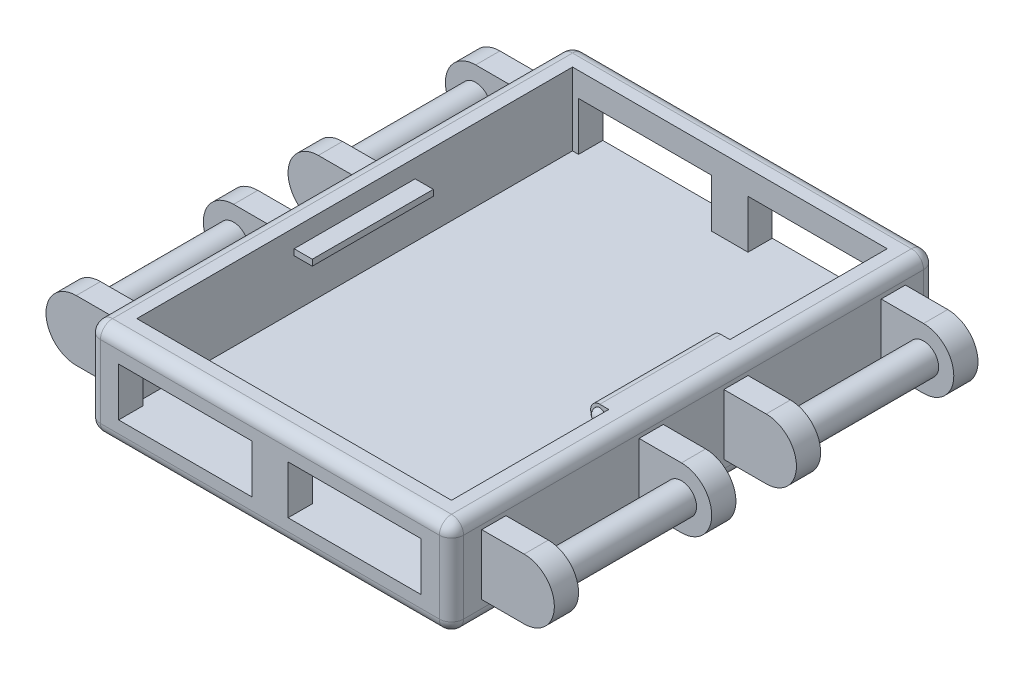
from build123d import *

# Parameters (mm, degrees)
SKETCH2_W                   = 60
SKETCH2_H                   = 80
BOSS_EXTRUDE2_DEPTH         = 16
SKETCH6_W                   = 52
SKETCH6_H                   = 72
CUT_EXTRUDE1_DEPTH          = 12
CUT_EXTRUDE2_DEPTH          = 16
CUT_EXTRUDE2_DEPTH_BACK     = 106
SKETCH7_W                   = 22
SKETCH7_H                   = 8
SKETCH8_W                   = 4
SKETCH8_H                   = 10
BOSS_EXTRUDE3_DEPTH         = 12
FILLET1_RADIUS              = 5
FILLET1_LENGTH              = 4
FILLET2_RADIUS              = 5
FILLET2_LENGTH              = 4
FILLET3_RADIUS              = 5
FILLET3_LENGTH              = 4
FILLET4_RADIUS              = 5
FILLET4_LENGTH              = 4
BOSS_EXTRUDE4_START         = -2
SKETCH9_R                   = 2.5
BOSS_EXTRUDE4_DEPTH         = 26
MIRROR2_START               = -2
MIRROR2_COPY_1_SKETCH_R     = 2.5
MIRROR2_COPY_1_DEPTH        = 26
FILLET1_OF_MIRROR2_2_RADIUS = 5
FILLET1_OF_MIRROR2_2_LENGTH = 4
FILLET2_OF_MIRROR2_2_RADIUS = 5
FILLET2_OF_MIRROR2_2_LENGTH = 4
FILLET3_OF_MIRROR2_2_RADIUS = 5
FILLET3_OF_MIRROR2_2_LENGTH = 4
FILLET4_OF_MIRROR2_2_RADIUS = 5
FILLET4_OF_MIRROR2_2_LENGTH = 4
SKETCH10_W                  = 20
SKETCH10_H                  = 1
BOSS_EXTRUDE5_DEPTH         = 2.999340988
SKETCH12_W                  = 20
SKETCH12_H                  = 3
BOSS_EXTRUDE6_DEPTH         = 3
FILLET6_RADIUS              = 1.5
FILLET6_LENGTH              = 20
FILLET7_R                   = 2
FILLET8_R                   = 2
FILLET9_R                   = 2
FILLET10_R                  = 2
FILLET11_R                  = 2


with BuildPart() as part:
    # Sketch2 → Boss-Extrude2 (new body)
    with BuildSketch(Plane(origin=(0, 0, 0), x_dir=(1, 0, 0), z_dir=(0, 1, 0))):
        Rectangle(SKETCH2_W, SKETCH2_H)
    extrude(amount=BOSS_EXTRUDE2_DEPTH)

    # Sketch6 → Cut-Extrude1 (cut)
    with BuildSketch(Plane(origin=(0, 16, 0), x_dir=(1, 0, 0), z_dir=(0, 1, 0))):
        Rectangle(SKETCH6_W, SKETCH6_H)
    extrude(amount=-CUT_EXTRUDE1_DEPTH, mode=Mode.SUBTRACT)

    # Sketch7 → Cut-Extrude2 (cut, two sides: drawn at the far end of the back side and taken through both)
    with BuildSketch(Plane(origin=(0, 0, -40), x_dir=(-1, 0, 0), z_dir=(0, 0, -1)).offset(-CUT_EXTRUDE2_DEPTH_BACK)):
        with Locations((-14, 8)):
            Rectangle(SKETCH7_W, SKETCH7_H)
        with Locations((14, 8)):
            Rectangle(SKETCH7_W, SKETCH7_H)
    extrude(amount=CUT_EXTRUDE2_DEPTH + CUT_EXTRUDE2_DEPTH_BACK, mode=Mode.SUBTRACT)

    # Sketch8 → Boss-Extrude3 (add)
    with BuildSketch(Plane(origin=(30, 0, 0), x_dir=(0, 0, -1), z_dir=(1, 0, 0))):
        with Locations((-33, 8.303078398)):
            Rectangle(SKETCH8_W, SKETCH8_H)
        with Locations((-7, 8.355173675)):
            Rectangle(SKETCH8_W, SKETCH8_H)
        with Locations((7, 8.355173675)):
            Rectangle(SKETCH8_W, SKETCH8_H)
        with Locations((33, 8.303078398)):
            Rectangle(SKETCH8_W, SKETCH8_H)
    boss_extrude3 = extrude(amount=BOSS_EXTRUDE3_DEPTH)

    # Fillet1: full round fillet: the end face becomes a half cylinder, R = half its width
    fillet1_face = Plane((42, 8.303078398, 33), x_dir=(0, 0, 1), z_dir=(1, 0, 0))  # on the end face: x along it, z out of the body
    fillet1_slab = fillet1_face.offset(-FILLET1_RADIUS / 2) * Box(FILLET1_LENGTH, 2 * FILLET1_RADIUS, FILLET1_RADIUS, mode=Mode.PRIVATE)  # the body's end, R deep
    fillet1_round = Plane((37, 8.303078398, 33), x_dir=(1, 0, 0), z_dir=(0, 0, 1)) * Cylinder(FILLET1_RADIUS, FILLET1_LENGTH, mode=Mode.PRIVATE)  # its axis R under the face
    add(fillet1_slab - fillet1_round, mode=Mode.SUBTRACT)

    # Fillet2: full round fillet: the end face becomes a half cylinder, R = half its width
    fillet2_face = Plane((42, 8.355173675, 7), x_dir=(0, 0, 1), z_dir=(1, 0, 0))  # on the end face: x along it, z out of the body
    fillet2_slab = fillet2_face.offset(-FILLET2_RADIUS / 2) * Box(FILLET2_LENGTH, 2 * FILLET2_RADIUS, FILLET2_RADIUS, mode=Mode.PRIVATE)  # the body's end, R deep
    fillet2_round = Plane((37, 8.355173675, 7), x_dir=(1, 0, 0), z_dir=(0, 0, 1)) * Cylinder(FILLET2_RADIUS, FILLET2_LENGTH, mode=Mode.PRIVATE)  # its axis R under the face
    add(fillet2_slab - fillet2_round, mode=Mode.SUBTRACT)

    # Fillet3: full round fillet: the end face becomes a half cylinder, R = half its width
    fillet3_face = Plane((42, 8.355173675, -7), x_dir=(0, 0, -1), z_dir=(1, 0, 0))  # on the end face: x along it, z out of the body
    fillet3_slab = fillet3_face.offset(-FILLET3_RADIUS / 2) * Box(FILLET3_LENGTH, 2 * FILLET3_RADIUS, FILLET3_RADIUS, mode=Mode.PRIVATE)  # the body's end, R deep
    fillet3_round = Plane((37, 8.355173675, -7), x_dir=(1, 0, 0), z_dir=(0, 0, -1)) * Cylinder(FILLET3_RADIUS, FILLET3_LENGTH, mode=Mode.PRIVATE)  # its axis R under the face
    add(fillet3_slab - fillet3_round, mode=Mode.SUBTRACT)

    # Fillet4: full round fillet: the end face becomes a half cylinder, R = half its width
    fillet4_face = Plane((42, 8.303078398, -33), x_dir=(0, 0, -1), z_dir=(1, 0, 0))  # on the end face: x along it, z out of the body
    fillet4_slab = fillet4_face.offset(-FILLET4_RADIUS / 2) * Box(FILLET4_LENGTH, 2 * FILLET4_RADIUS, FILLET4_RADIUS, mode=Mode.PRIVATE)  # the body's end, R deep
    fillet4_round = Plane((37, 8.303078398, -33), x_dir=(1, 0, 0), z_dir=(0, 0, -1)) * Cylinder(FILLET4_RADIUS, FILLET4_LENGTH, mode=Mode.PRIVATE)  # its axis R under the face
    add(fillet4_slab - fillet4_round, mode=Mode.SUBTRACT)

    # Sketch9 → Boss-Extrude4 (add)
    with BuildSketch(Plane(origin=(0, 0, 31), x_dir=(-1, 0, 0), z_dir=(0, 0, -1)).offset(BOSS_EXTRUDE4_START)):
        with Locations(Location((-37, 8.303078398, 0), (0, 0, 180))):
            Circle(SKETCH9_R)
    boss_extrude4 = extrude(amount=BOSS_EXTRUDE4_DEPTH)

    # Mirror1: Boss-Extrude4 across plane
    add(boss_extrude4.mirror(Plane(origin=(0, 0, 0), x_dir=(1, 0, 0), z_dir=(0, 0, -1))))

    # Mirror2: Boss-Extrude3, Boss-Extrude4 across plane
    add(boss_extrude3.mirror(Plane(origin=(0, 0, 0), x_dir=(0, 0, 1), z_dir=(1, 0, 0))))
    add(boss_extrude4.mirror(Plane(origin=(0, 0, 0), x_dir=(0, 0, 1), z_dir=(1, 0, 0))))

    # Mirror2 copy 1 sketch → Mirror2 copy 1 (add)
    with BuildSketch(Plane.XY.offset(-31).offset(MIRROR2_START)):
        with Locations(Location((-37, 8.303078398, 0), (0, 0, 180))):
            Circle(MIRROR2_COPY_1_SKETCH_R)
    extrude(amount=MIRROR2_COPY_1_DEPTH)

    # Fillet1 of Mirror2 2: full round fillet: the end face becomes a half cylinder, R = half its width
    fillet1_of_mirror2_2_face = Plane((-42, 8.303078398, 33), x_dir=(0, 0, 1), z_dir=(-1, 0, 0))  # on the end face: x along it, z out of the body
    fillet1_of_mirror2_2_slab = fillet1_of_mirror2_2_face.offset(-FILLET1_OF_MIRROR2_2_RADIUS / 2) * Box(FILLET1_OF_MIRROR2_2_LENGTH, 2 * FILLET1_OF_MIRROR2_2_RADIUS, FILLET1_OF_MIRROR2_2_RADIUS, mode=Mode.PRIVATE)  # the body's end, R deep
    fillet1_of_mirror2_2_round = Plane((-37, 8.303078398, 33), x_dir=(-1, 0, 0), z_dir=(0, 0, 1)) * Cylinder(FILLET1_OF_MIRROR2_2_RADIUS, FILLET1_OF_MIRROR2_2_LENGTH, mode=Mode.PRIVATE)  # its axis R under the face
    add(fillet1_of_mirror2_2_slab - fillet1_of_mirror2_2_round, mode=Mode.SUBTRACT)

    # Fillet2 of Mirror2 2: full round fillet: the end face becomes a half cylinder, R = half its width
    fillet2_of_mirror2_2_face = Plane((-42, 8.355173675, 7), x_dir=(0, 0, 1), z_dir=(-1, 0, 0))  # on the end face: x along it, z out of the body
    fillet2_of_mirror2_2_slab = fillet2_of_mirror2_2_face.offset(-FILLET2_OF_MIRROR2_2_RADIUS / 2) * Box(FILLET2_OF_MIRROR2_2_LENGTH, 2 * FILLET2_OF_MIRROR2_2_RADIUS, FILLET2_OF_MIRROR2_2_RADIUS, mode=Mode.PRIVATE)  # the body's end, R deep
    fillet2_of_mirror2_2_round = Plane((-37, 8.355173675, 7), x_dir=(-1, 0, 0), z_dir=(0, 0, 1)) * Cylinder(FILLET2_OF_MIRROR2_2_RADIUS, FILLET2_OF_MIRROR2_2_LENGTH, mode=Mode.PRIVATE)  # its axis R under the face
    add(fillet2_of_mirror2_2_slab - fillet2_of_mirror2_2_round, mode=Mode.SUBTRACT)

    # Fillet3 of Mirror2 2: full round fillet: the end face becomes a half cylinder, R = half its width
    fillet3_of_mirror2_2_face = Plane((-42, 8.355173675, -7), x_dir=(0, 0, -1), z_dir=(-1, 0, 0))  # on the end face: x along it, z out of the body
    fillet3_of_mirror2_2_slab = fillet3_of_mirror2_2_face.offset(-FILLET3_OF_MIRROR2_2_RADIUS / 2) * Box(FILLET3_OF_MIRROR2_2_LENGTH, 2 * FILLET3_OF_MIRROR2_2_RADIUS, FILLET3_OF_MIRROR2_2_RADIUS, mode=Mode.PRIVATE)  # the body's end, R deep
    fillet3_of_mirror2_2_round = Plane((-37, 8.355173675, -7), x_dir=(-1, 0, 0), z_dir=(0, 0, -1)) * Cylinder(FILLET3_OF_MIRROR2_2_RADIUS, FILLET3_OF_MIRROR2_2_LENGTH, mode=Mode.PRIVATE)  # its axis R under the face
    add(fillet3_of_mirror2_2_slab - fillet3_of_mirror2_2_round, mode=Mode.SUBTRACT)

    # Fillet4 of Mirror2 2: full round fillet: the end face becomes a half cylinder, R = half its width
    fillet4_of_mirror2_2_face = Plane((-42, 8.303078398, -33), x_dir=(0, 0, -1), z_dir=(-1, 0, 0))  # on the end face: x along it, z out of the body
    fillet4_of_mirror2_2_slab = fillet4_of_mirror2_2_face.offset(-FILLET4_OF_MIRROR2_2_RADIUS / 2) * Box(FILLET4_OF_MIRROR2_2_LENGTH, 2 * FILLET4_OF_MIRROR2_2_RADIUS, FILLET4_OF_MIRROR2_2_RADIUS, mode=Mode.PRIVATE)  # the body's end, R deep
    fillet4_of_mirror2_2_round = Plane((-37, 8.303078398, -33), x_dir=(-1, 0, 0), z_dir=(0, 0, -1)) * Cylinder(FILLET4_OF_MIRROR2_2_RADIUS, FILLET4_OF_MIRROR2_2_LENGTH, mode=Mode.PRIVATE)  # its axis R under the face
    add(fillet4_of_mirror2_2_slab - fillet4_of_mirror2_2_round, mode=Mode.SUBTRACT)

    # Sketch10 → Boss-Extrude5 (add)
    with BuildSketch(Plane(origin=(-26, 0, 0), x_dir=(0, 0, -1), z_dir=(1, 0, 0))):
        with Locations((0, 12.5)):
            Rectangle(SKETCH10_W, SKETCH10_H)
    extrude(amount=BOSS_EXTRUDE5_DEPTH)

    # Sketch12 → Boss-Extrude6 (add)
    with BuildSketch(Plane.ZY.offset(-26)):
        with Locations((0, 14.5)):
            Rectangle(SKETCH12_W, SKETCH12_H)
    extrude(amount=BOSS_EXTRUDE6_DEPTH)

    # Sketch13 → Revolve1 (revolve)
    with BuildSketch(Plane.XY.offset(10)):
        with BuildLine():
            Line((23.50027011, 14.5), (25.49972989, 14.5))
            ThreePointArc((25.49972989, 14.5), (24.5, 13.50027011), (23.50027011, 14.5))
        make_face()
    revolve1 = revolve(axis=Axis((23.50027011, 14.5, 10), (1, 0, 0)))

    # Mirror3: Revolve1 across plane
    add(revolve1.mirror(Plane(origin=(0, 0, 0), x_dir=(1, 0, 0), z_dir=(0, 0, -1))))

    # Fillet6: full round fillet: the end face becomes a half cylinder, R = half its width
    fillet6_face = Plane((23, 14.5, 0), x_dir=(0, 0, -1), z_dir=(-1, 0, 0))  # on the end face: x along it, z out of the body
    fillet6_slab = fillet6_face.offset(-FILLET6_RADIUS / 2) * Box(FILLET6_LENGTH, 2 * FILLET6_RADIUS, FILLET6_RADIUS, mode=Mode.PRIVATE)  # the body's end, R deep
    fillet6_round = Plane((24.5, 14.5, 0), x_dir=(-1, 0, 0), z_dir=(0, 0, -1)) * Cylinder(FILLET6_RADIUS, FILLET6_LENGTH, mode=Mode.PRIVATE)  # its axis R under the face
    add(fillet6_slab - fillet6_round, mode=Mode.SUBTRACT)

    # Fillet7
    fillet7_edges = [part.edges().sort_by_distance(p)[0] for p in [
        (-30, 16, 0),
    ]]
    fillet(fillet7_edges, radius=FILLET7_R)

    # Fillet8
    fillet8_edges = [part.edges().sort_by_distance(p)[0] for p in [
        (1, 16, -40),
        (-30, 7, -40),
        (-29.414213562, 15.414213562, -40),
    ]]
    fillet(fillet8_edges, radius=FILLET8_R)

    # Fillet9
    fillet9_edges = [part.edges().sort_by_distance(p)[0] for p in [
        (30, 16, 1),
        (30, 7, -40),
        (30, 15.414213562, -39.414213562),
    ]]
    fillet(fillet9_edges, radius=FILLET9_R)

    # Fillet10
    fillet10_edges = [part.edges().sort_by_distance(p)[0] for p in [
        (0, 16, 40),
        (-30, 7, 40),
        (-29.414213562, 15.414213562, 40),
        (30, 7, 40),
        (29.414213562, 15.414213562, 40),
    ]]
    fillet(fillet10_edges, radius=FILLET10_R)

    # Fillet11
    fillet11_edges = [part.edges().sort_by_distance(p)[0] for p in [
        (0, 0, -40),
        (-30, 0, 0),
        (-29.414213562, 0, -39.414213562),
        (30, 0, 0),
        (29.414213562, 0, -39.414213562),
        (0, 0, 40),
        (29.414213562, 0, 39.414213562),
        (-29.414213562, 0, 39.414213562),
    ]]
    fillet(fillet11_edges, radius=FILLET11_R)


solid = part.part
